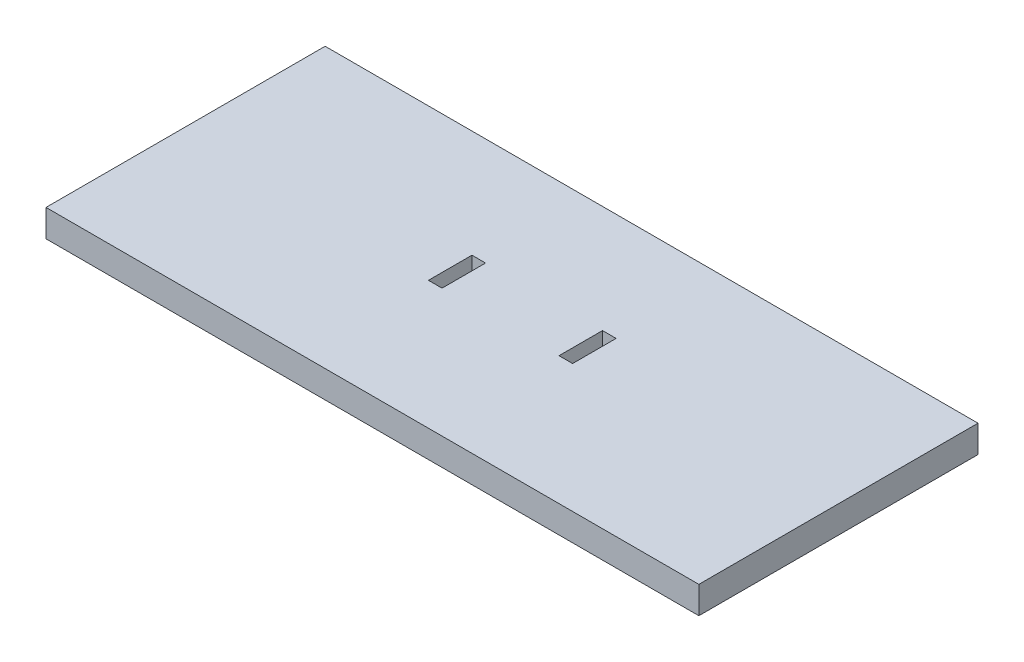
from build123d import *

# Parameters (mm, degrees)
SKETCH1_W           = 120
SKETCH1_H           = 51.307
SKETCH1_W_2         = 2.5
SKETCH1_H_2         = 8
BOSS_EXTRUDE1_DEPTH = 5


with BuildPart() as part:
    # Sketch1 → Boss-Extrude1 (new body)
    with BuildSketch(Plane(origin=(0, 0, 0), x_dir=(1, 0, 0), z_dir=(0, 1, 0))):
        Rectangle(SKETCH1_W, SKETCH1_H)
        with Locations((-12, 1.888343811)):
            Rectangle(SKETCH1_W_2, SKETCH1_H_2, mode=Mode.SUBTRACT)
        with Locations((12, 1.888343811)):
            Rectangle(SKETCH1_W_2, SKETCH1_H_2, mode=Mode.SUBTRACT)
    extrude(amount=BOSS_EXTRUDE1_DEPTH)


solid = part.part
